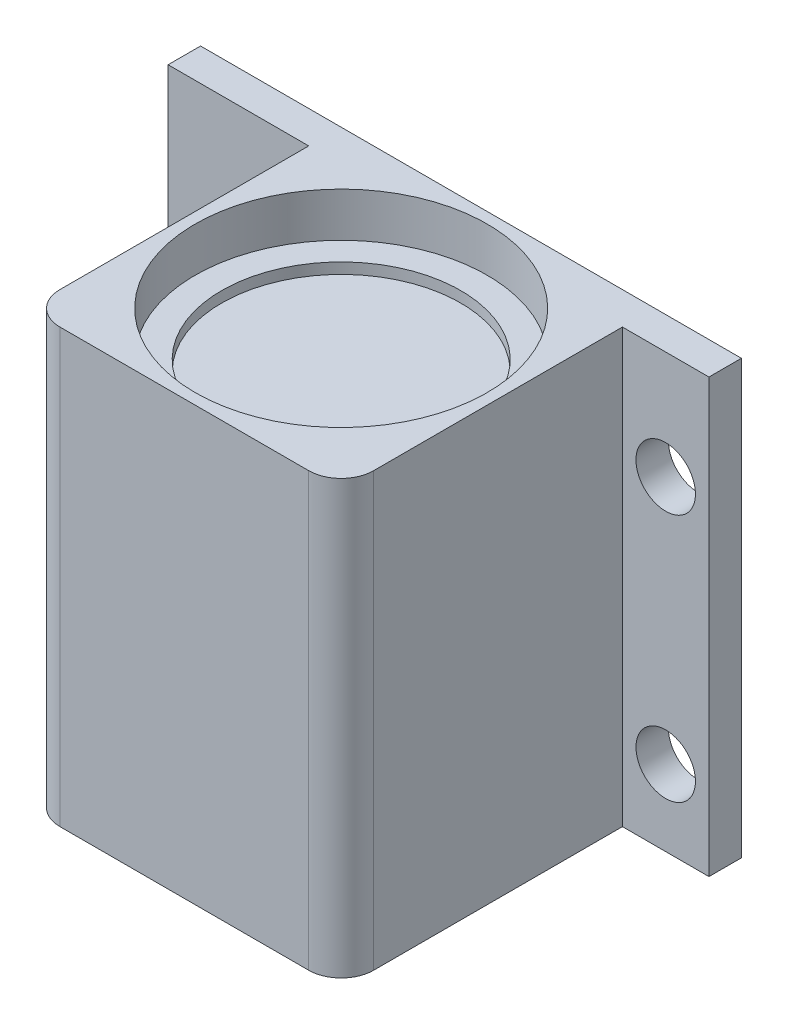
from build123d import *

# Parameters (mm, degrees)
BOSS_EXTRUDE1_DEPTH     = 40
CUT_EXTRUDE1_DEPTH      = 49.130032204
CUT_EXTRUDE1_DEPTH_BACK = 4.1
SKETCH2_R               = 13.5
SKETCH7_R               = 11.05
CUT_EXTRUDE3_DEPTH      = 1
M5_CLEARANCE_HOLE2_D    = 5.5
FILLET1_R               = 3
SKETCH8_W               = 5
SKETCH8_H               = 40
BOSS_EXTRUDE2_DEPTH     = 3


with BuildPart() as part:
    # Sketch1 → Boss-Extrude1 (new body)
    with BuildSketch(Plane(origin=(0, 0, 0), x_dir=(1, 0, 0), z_dir=(0, 1, 0))):
        Polygon((-22.5, 14.5), (22.5, 14.5), (22.5, 11.5), (14.5, 11.5), (14.5, -14.5), (-14.5, -14.5), (-14.5, 11.5), (-22.5, 11.5), align=None)
    extrude(amount=-BOSS_EXTRUDE1_DEPTH)

    # Sketch2 → Cut-Extrude1 (cut, two sides: drawn at the far end of the back side and taken through both)
    with BuildSketch(Plane(origin=(0, 0, 0), x_dir=(1, 0, 0), z_dir=(0, 1, 0)).offset(-CUT_EXTRUDE1_DEPTH_BACK)):
        with Locations(Location((0, 0, 0), (0, 0, 270))):
            Circle(SKETCH2_R)
    extrude(amount=CUT_EXTRUDE1_DEPTH + CUT_EXTRUDE1_DEPTH_BACK, mode=Mode.SUBTRACT)

    # Sketch7 → Cut-Extrude3 (cut)
    with BuildSketch(Plane(origin=(0, -4.1, 0), x_dir=(1, 0, 0), z_dir=(0, 1, 0))):
        with Locations(Location((0, 0, 0), (0, 0, 270))):
            Circle(SKETCH7_R)
    extrude(amount=-CUT_EXTRUDE3_DEPTH, mode=Mode.SUBTRACT)

    # M5 Clearance Hole2 (through all)
    with Locations(Plane.XY.offset(-11.5)):
        with Locations((18.5, -33), (-18.5, -10), (18.5, -10), (-18.5, -33)):
            Hole(M5_CLEARANCE_HOLE2_D / 2)

    # Fillet1
    fillet1_edges = [part.edges().sort_by_distance(p)[0] for p in [
        (-14.5, -20, 14.5),
        (14.5, -20, 14.5),
    ]]
    fillet(fillet1_edges, radius=FILLET1_R)

    # Sketch8 → Boss-Extrude2 (add)
    with BuildSketch(Plane.XY.offset(-11.5)):
        with Locations((-25, -20)):
            Rectangle(SKETCH8_W, SKETCH8_H)
    extrude(amount=-BOSS_EXTRUDE2_DEPTH)


solid = part.part
